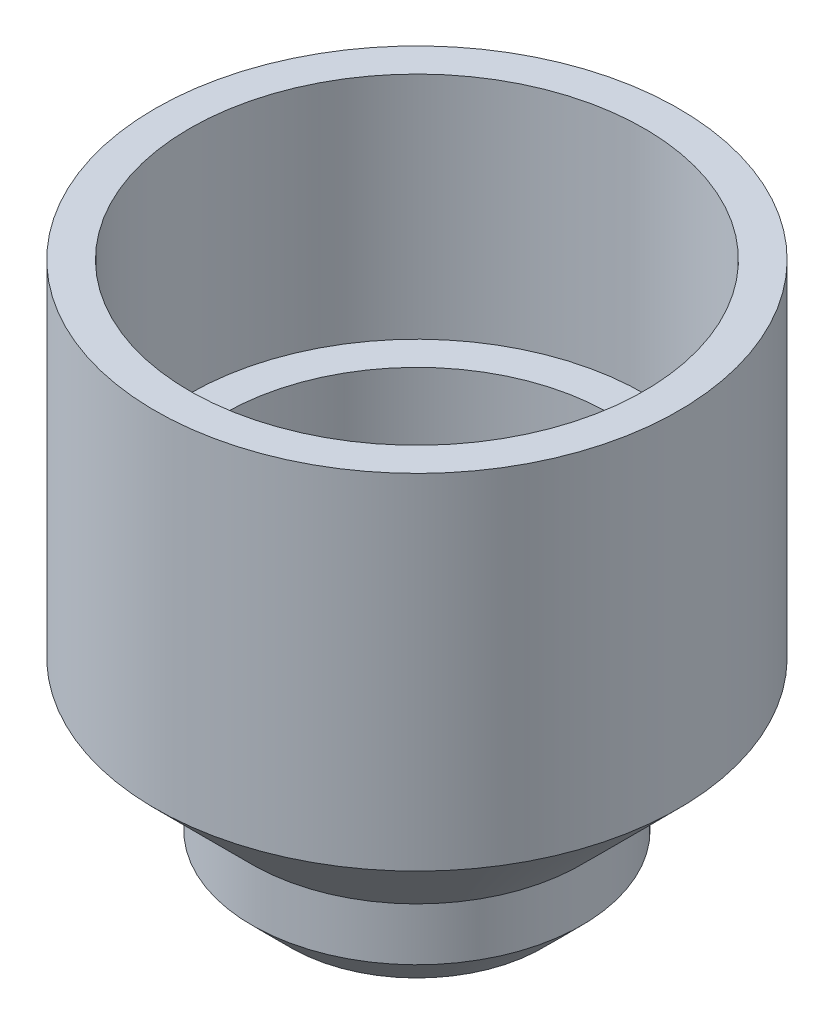
from build123d import *


with BuildPart() as part:
    # Sketch1 → Revolve1 (revolve)
    with BuildSketch(Plane.XY, mode=Mode.PRIVATE) as revolve1_sk:
        Polygon((7.180253608, -6.515318278), (7.180253608, -4.219746392), (5.480253608, -5.919746392), (5.480253608, -8.215318278), align=None)
        Polygon((7.4, -1), (5.480253608, -2.919746392), (5.480253608, -5.919746392), (7.4, -4), align=None)
        Polygon((7.4, -1), (7.4, -4), (11.4, 0), (11.4, 3), (8.4, 0), align=None)
        Polygon((8.4, 0), (11.4, 3), (11.4, 15), (9.9, 15), (9.9, 5), (8.4, 5), align=None)
    revolve(revolve1_sk.sketch.rotate(Axis((0, 51.27419464, 0), (0, -1, 0)), 180), axis=Axis((0, 51.27419464, 0), (0, -1, 0)))


solid = part.part
